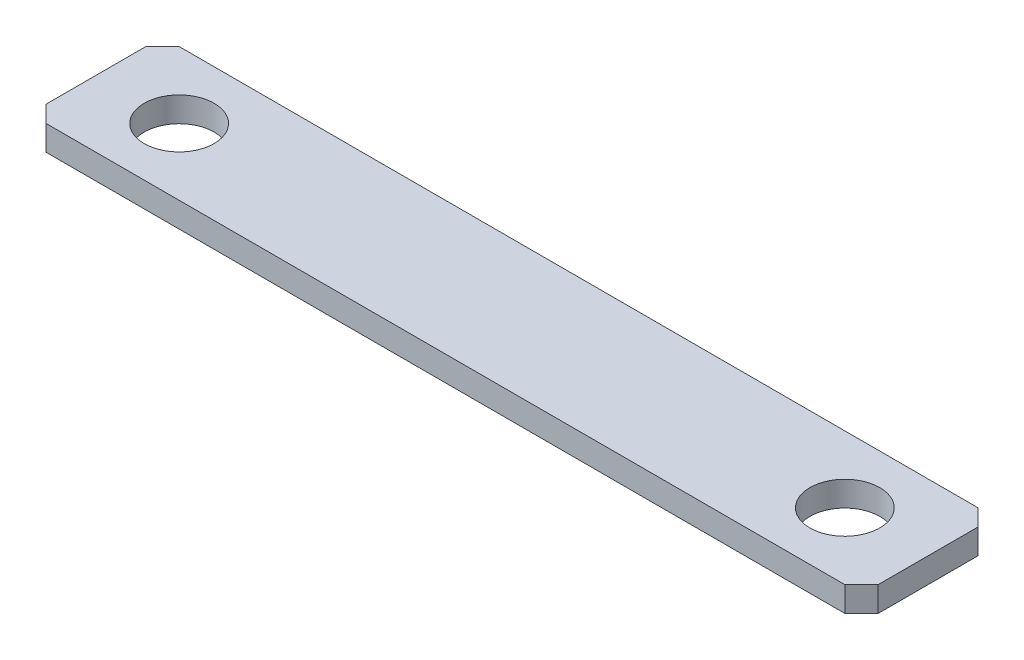
from build123d import *

# Parameters (mm, degrees)
SKETCH_1_W          = 50
SKETCH_1_H          = 8
EXTRUDE_1_DEPTH     = 1.5
SKETCH_2_R          = 2.1
CUT_EXTRUDE_1_DEPTH = 26.362373706
CHAMFER_1_SIZE      = 1


with BuildPart() as part:
    # 草图1 → 凸台-拉伸1 (new body)
    with BuildSketch(Plane(origin=(0, 0, 0), x_dir=(1, 0, 0), z_dir=(0, 1, 0))):
        Rectangle(SKETCH_1_W, SKETCH_1_H)
    extrude(amount=EXTRUDE_1_DEPTH)

    # 草图2 → 切除-拉伸1 (cut, through all)
    with BuildSketch(Plane(origin=(0, 1.5, 0), x_dir=(1, 0, 0), z_dir=(0, 1, 0))):
        with Locations(Location((-20, 0, 0), (0, 0, 270))):
            Circle(SKETCH_2_R)
        with Locations(Location((20, 0, 0), (0, 0, 90))):
            Circle(SKETCH_2_R)
    extrude(amount=-CUT_EXTRUDE_1_DEPTH, mode=Mode.SUBTRACT)

    # 倒角1
    chamfer_1_edges = [part.edges().sort_by_distance(p)[0] for p in [
        (25, 0.75, 4),
        (-25, 0.75, 4),
        (-25, 0.75, -4),
        (25, 0.75, -4),
    ]]
    chamfer(chamfer_1_edges, length=CHAMFER_1_SIZE)


solid = part.part
